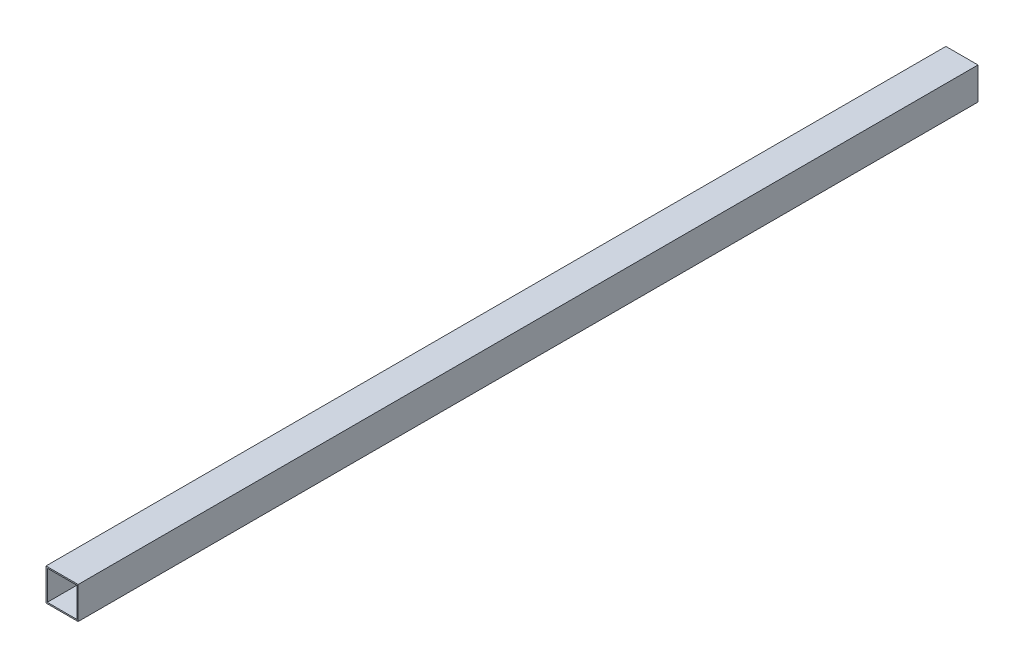
from build123d import *

# Parameters (mm, degrees)
SKETCH1_W           = 30
SKETCH1_H           = 30
SKETCH1_W_2         = 27.6
SKETCH1_H_2         = 27.6
BOSS_EXTRUDE1_DEPTH = 840


with BuildPart() as part:
    # Sketch1 → Boss-Extrude1 (new body)
    with BuildSketch(Plane.XY):
        Rectangle(SKETCH1_W, SKETCH1_H)
        Rectangle(SKETCH1_W_2, SKETCH1_H_2, mode=Mode.SUBTRACT)
    extrude(amount=BOSS_EXTRUDE1_DEPTH)


solid = part.part
